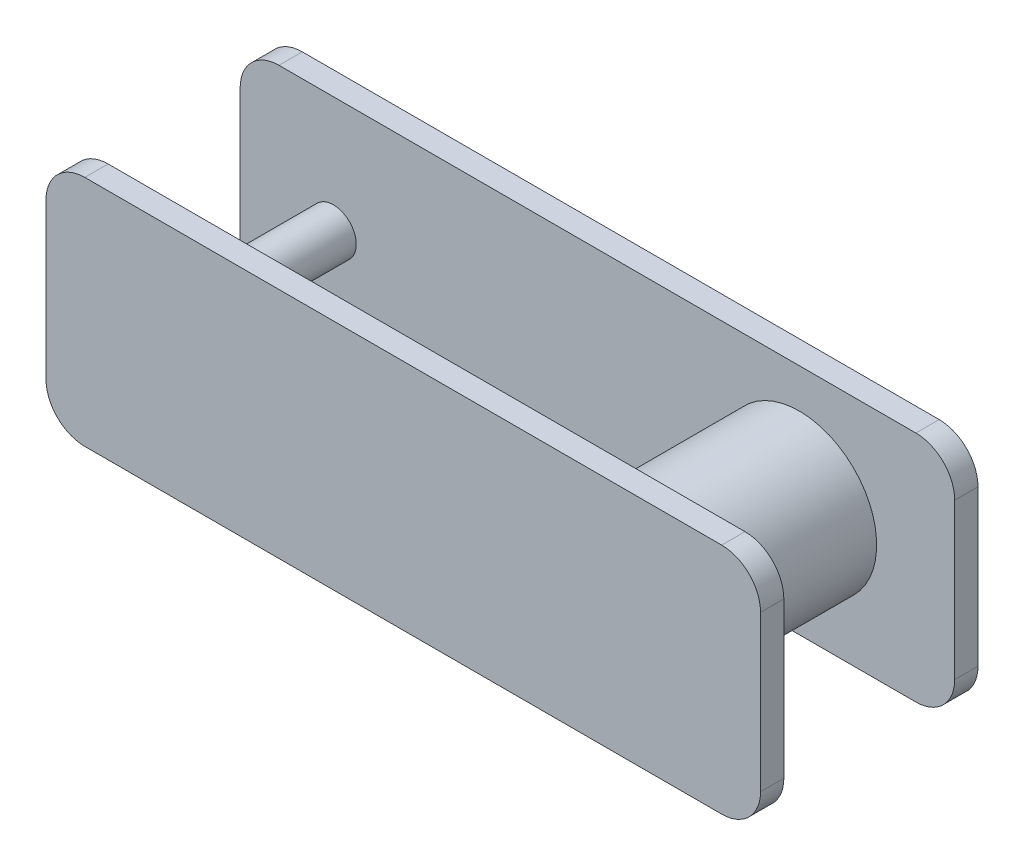
from build123d import *

# Parameters (mm, degrees)
BOSS_EXTRUDE1_DEPTH = 3
SKETCH2_R           = 2.95
SKETCH2_R_2         = 9.95
BOSS_EXTRUDE2_DEPTH = 22
BOSS_EXTRUDE3_DEPTH = 3


with BuildPart() as part:
    # Sketch1 → Boss-Extrude1 (new body)
    with BuildSketch(Plane.XY):
        with BuildLine():
            Line((-7, 15), (75, 15))
            ThreePointArc((75, 15), (78.535533906, 13.535533906), (80, 10))
            Line((80, 10), (80, -10))
            ThreePointArc((80, -10), (78.535533906, -13.535533906), (75, -15))
            Line((75, -15), (-7, -15))
            ThreePointArc((-7, -15), (-10.535533906, -13.535533906), (-12, -10))
            Line((-12, -10), (-12, 10))
            ThreePointArc((-12, 10), (-10.535533906, 13.535533906), (-7, 15))
        make_face()
    extrude(amount=BOSS_EXTRUDE1_DEPTH)

    # Sketch2 → Boss-Extrude2 (add)
    with BuildSketch(Plane.XY.offset(3)):
        with Locations(Location((0, 0, 0), (0, 0, 180))):
            Circle(SKETCH2_R)
        with Locations(Location((60, 0, 0), (0, 0, 180))):
            Circle(SKETCH2_R_2)
    extrude(amount=BOSS_EXTRUDE2_DEPTH)

    # Sketch3 → Boss-Extrude3 (add)
    with BuildSketch(Plane.XY.offset(25)):
        with BuildLine():
            Line((75, 15), (-7, 15))
            ThreePointArc((-7, 15), (-10.535533906, 13.535533906), (-12, 10))
            Line((-12, 10), (-12, -10))
            ThreePointArc((-12, -10), (-10.535533906, -13.535533906), (-7, -15))
            Line((-7, -15), (75, -15))
            ThreePointArc((75, -15), (78.535533906, -13.535533906), (80, -10))
            Line((80, -10), (80, 10))
            ThreePointArc((80, 10), (78.535533906, 13.535533906), (75, 15))
        make_face()
    extrude(amount=BOSS_EXTRUDE3_DEPTH)


solid = part.part
